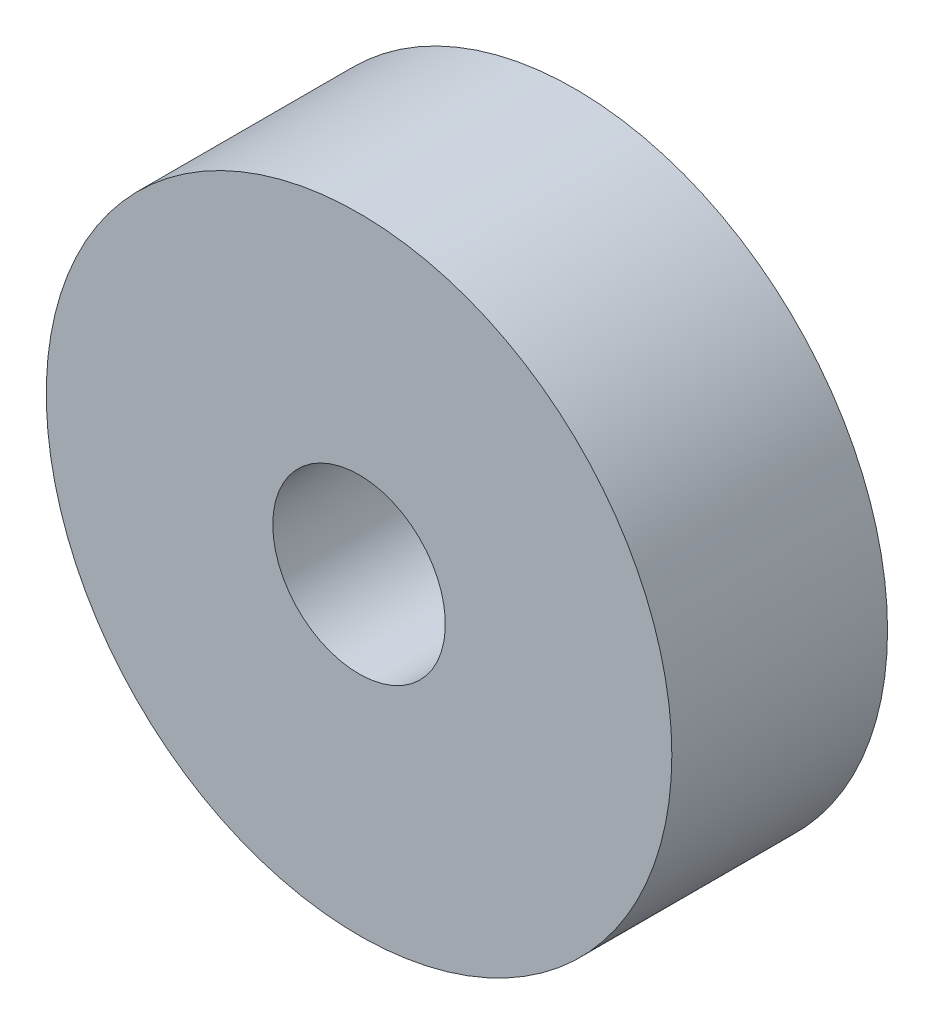
from build123d import *

# Parameters (mm, degrees)
SKETCH2_R           = 18.415
BOSS_EXTRUDE1_DEPTH = 12.7
SKETCH3_R           = 5.08
CUT_EXTRUDE1_DEPTH  = 29.974375748


with BuildPart() as part:
    # Sketch2 → Boss-Extrude1 (new body)
    with BuildSketch(Plane.XY):
        Circle(SKETCH2_R)
    extrude(amount=BOSS_EXTRUDE1_DEPTH)

    # Sketch3 → Cut-Extrude1 (cut, through all)
    with BuildSketch(Plane(origin=(0, 0, 0), x_dir=(-1, 0, 0), z_dir=(0, 0, -1))):
        Circle(SKETCH3_R)
    extrude(amount=-CUT_EXTRUDE1_DEPTH, mode=Mode.SUBTRACT)


solid = part.part
